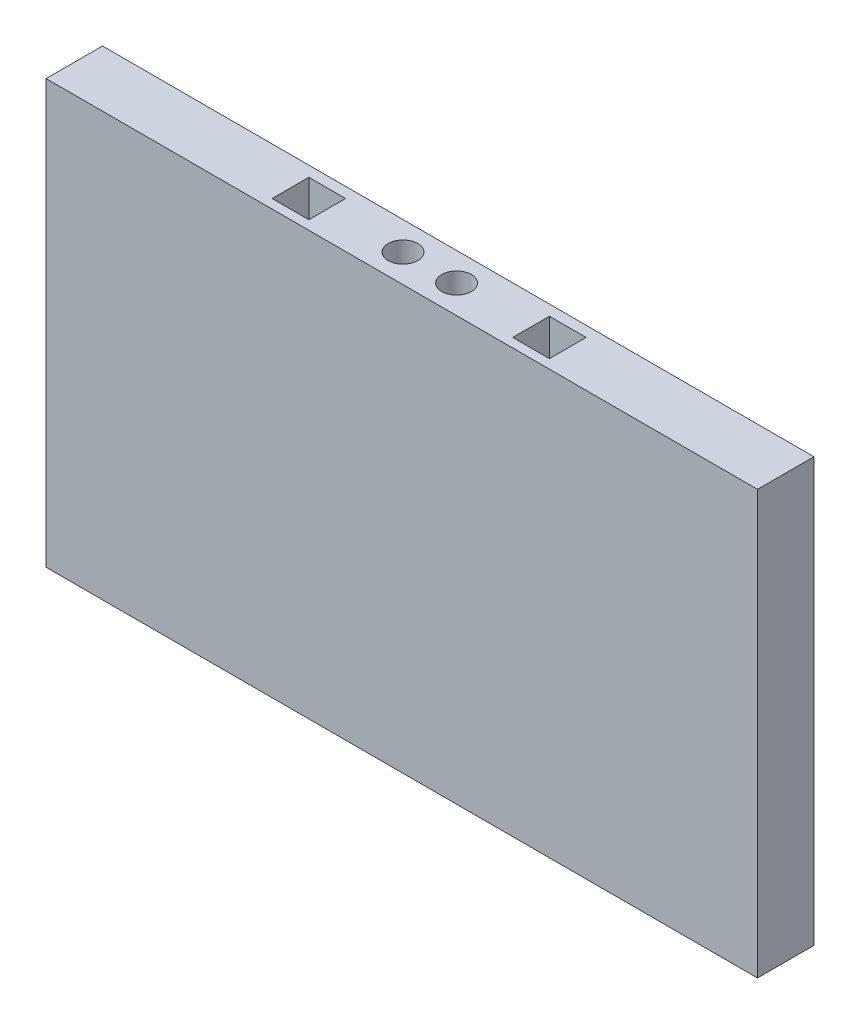
from build123d import *

# Parameters (mm, degrees)
BOSS_EXTRUDE1_DEPTH = 20
SKETCH5_R           = 5.25
CUT_EXTRUDE4_DEPTH  = 20
SKETCH6_W           = 13
SKETCH6_H           = 13
CUT_EXTRUDE5_DEPTH  = 15.5
SKETCH7_W           = 13
SKETCH7_H           = 13
CUT_EXTRUDE6_DEPTH  = 15.5
SKETCH8_W           = 300
SKETCH8_H           = 102
BOSS_EXTRUDE2_DEPTH = 20
CUT_EXTRUDE7_START  = -150
SKETCH9_W           = 47.842391085
SKETCH9_H           = 20
CUT_EXTRUDE7_DEPTH  = 150


with BuildPart() as part:
    # Sketch1 → Boss-Extrude1 (new body)
    with BuildSketch(Plane.XY):
        Polygon((-107.821386225, 92.09039548), (-7.821386225, 92.09039548), (117.178613775, 92.09039548), (117.178613775, 44.09039548), (-7.821386225, 44.09039548), (-107.821386225, 44.09039548), (-182.821386225, 44.09039548), (-182.821386225, 92.09039548), align=None)
    extrude(amount=BOSS_EXTRUDE1_DEPTH)

    # Sketch5 → Cut-Extrude4 (cut)
    with BuildSketch(Plane(origin=(0, 92.09039548, 0), x_dir=(1, 0, 0), z_dir=(0, 1, 0))):
        with Locations(Location((-66.321386225, -10, 0), (0, 0, 180))):
            Circle(SKETCH5_R)
        with Locations(Location((-47.321386225, -10, 0), (0, 0, 180))):
            Circle(SKETCH5_R)
    extrude(amount=-CUT_EXTRUDE4_DEPTH, mode=Mode.SUBTRACT)

    # Sketch6 → Cut-Extrude5 (cut)
    with BuildSketch(Plane(origin=(0, 92.09039548, 0), x_dir=(1, 0, 0), z_dir=(0, 1, 0))):
        with Locations((-99.441386225, -10.25)):
            Rectangle(SKETCH6_W, SKETCH6_H)
    extrude(amount=-CUT_EXTRUDE5_DEPTH, mode=Mode.SUBTRACT)

    # Sketch7 → Cut-Extrude6 (cut)
    with BuildSketch(Plane(origin=(0, 92.09039548, 0), x_dir=(1, 0, 0), z_dir=(0, 1, 0))):
        with Locations((-14.16377731, -10.25)):
            Rectangle(SKETCH7_W, SKETCH7_H)
    extrude(amount=-CUT_EXTRUDE6_DEPTH, mode=Mode.SUBTRACT)

    # Sketch8 → Boss-Extrude2 (add)
    with BuildSketch(Plane.XY.offset(20)):
        with Locations((-32.821386225, -6.90960452)):
            Rectangle(SKETCH8_W, SKETCH8_H)
    extrude(amount=-BOSS_EXTRUDE2_DEPTH)

    # Sketch9 → Cut-Extrude7 (cut)
    with BuildSketch(Plane(origin=(0, 92.09039548, 0), x_dir=(1, 0, 0), z_dir=(0, 1, 0)).offset(CUT_EXTRUDE7_START)):
        with Locations((93.257418233, -10)):
            Rectangle(SKETCH9_W, SKETCH9_H)
    extrude(amount=CUT_EXTRUDE7_DEPTH, mode=Mode.SUBTRACT)


solid = part.part
